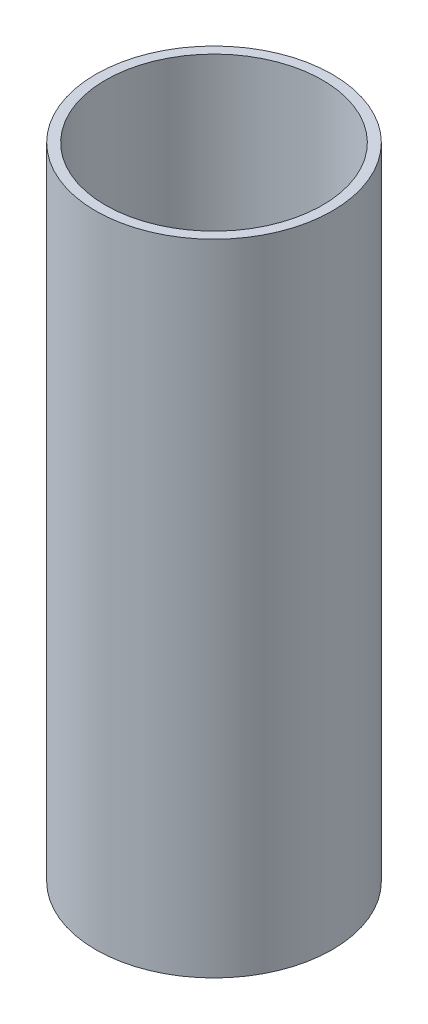
from build123d import *

# Parameters (mm, degrees)
SKETCH1_R           = 76.2
SKETCH1_R_2         = 69.85
BOSS_EXTRUDE1_DEPTH = 412


with BuildPart() as part:
    # Sketch1 → Boss-Extrude1 (new body)
    with BuildSketch(Plane(origin=(0, 0, 0), x_dir=(1, 0, 0), z_dir=(0, 1, 0))):
        with Locations(Location((0, 0, 0), (0, 0, 270))):
            Circle(SKETCH1_R)
        with Locations(Location((0, 0, 0), (0, 0, 270))):
            Circle(SKETCH1_R_2, mode=Mode.SUBTRACT)
    extrude(amount=BOSS_EXTRUDE1_DEPTH)


solid = part.part
